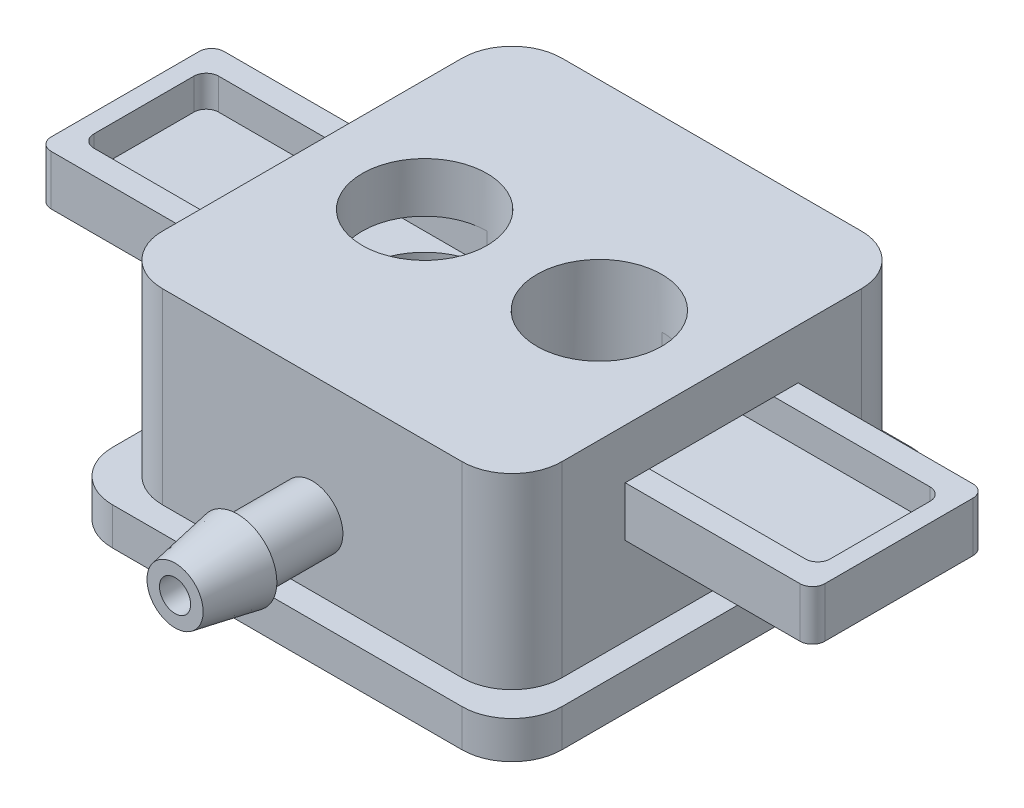
from build123d import *

# Parameters (mm, degrees)
BOSS_EXTRUDE2_DEPTH            = 7
BOSS_EXTRUDE3_DEPTH            = 2
CUT_EXTRUDE1_DEPTH             = 1.25
SKETCH6_R                      = 2.5
BOSS_EXTRUDE4_DEPTH            = 2
BOSS_EXTRUDE5_DEPTH            = 1.5
SKETCH7_R                      = 2.5
CUT_EXTRUDE2_DEPTH             = 19.823190484
SKETCH18_R                     = 0.625
CUT_EXTRUDE5_DEPTH             = 8.5
CUT_EXTRUDE6_REACH             = 24.439
SKETCH20_R                     = 0.625
CUT_EXTRUDE6_DIRECTION_2_REACH = 24.439


with BuildPart() as part:
    # Sketch3 → Boss-Extrude2 (new body)
    with BuildSketch(Plane(origin=(0, 0, 0), x_dir=(1, 0, 0), z_dir=(0, 1, 0))):
        with BuildLine():
            Line((-6, -8), (6, -8))
            ThreePointArc((6, -8), (7.414213562, -7.414213562), (8, -6))
            Line((8, -6), (8, 6))
            ThreePointArc((8, 6), (7.414213562, 7.414213562), (6, 8))
            Line((6, 8), (-6, 8))
            ThreePointArc((-6, 8), (-7.414213562, 7.414213562), (-8, 6))
            Line((-8, 6), (-8, -6))
            ThreePointArc((-8, -6), (-7.414213562, -7.414213562), (-6, -8))
        make_face()
    extrude(amount=BOSS_EXTRUDE2_DEPTH)

    # Sketch4 → Boss-Extrude3 (add)
    with BuildSketch(Plane(origin=(0, 7, 0), x_dir=(1, 0, 0), z_dir=(0, 1, 0))):
        with BuildLine():
            Line((-8, -3.465), (-8, 3.465))
            Line((-8, 3.465), (-15, 3.465))
            ThreePointArc((-15, 3.465), (-15.353553391, 3.318553391), (-15.5, 2.965))
            Line((-15.5, 2.965), (-15.5, -2.965))
            ThreePointArc((-15.5, -2.965), (-15.353553391, -3.318553391), (-15, -3.465))
            Line((-15, -3.465), (-8, -3.465))
        make_face()
        with BuildLine():
            Line((15, 3.465), (8, 3.465))
            Line((8, 3.465), (8, -3.465))
            Line((8, -3.465), (15, -3.465))
            ThreePointArc((15, -3.465), (15.353553391, -3.318553391), (15.5, -2.965))
            Line((15.5, -2.965), (15.5, 2.965))
            ThreePointArc((15.5, 2.965), (15.353553391, 3.318553391), (15, 3.465))
        make_face()
    extrude(amount=-BOSS_EXTRUDE3_DEPTH)

    # Sketch5 → Cut-Extrude1 (cut)
    with BuildSketch(Plane(origin=(0, 7, 0), x_dir=(1, 0, 0), z_dir=(0, 1, 0))):
        with BuildLine():
            Line((-3.5, 2.5), (-14.25, 2.5))
            ThreePointArc((-14.25, 2.5), (-14.603553391, 2.353553391), (-14.75, 2))
            Line((-14.75, 2), (-14.75, -2))
            ThreePointArc((-14.75, -2), (-14.603553391, -2.353553391), (-14.25, -2.5))
            Line((-14.25, -2.5), (-3.5, -2.5))
            ThreePointArc((-3.5, -2.5), (-1, 0), (-3.5, 2.5))
        make_face()
        with BuildLine():
            Line((3.5, 2.5), (14.25, 2.5))
            ThreePointArc((14.25, 2.5), (14.603553391, 2.353553391), (14.75, 2))
            Line((14.75, 2), (14.75, -2))
            ThreePointArc((14.75, -2), (14.603553391, -2.353553391), (14.25, -2.5))
            Line((14.25, -2.5), (3.5, -2.5))
            ThreePointArc((3.5, -2.5), (1, 0), (3.5, 2.5))
        make_face()
    extrude(amount=-CUT_EXTRUDE1_DEPTH, mode=Mode.SUBTRACT)

    # Sketch6 → Boss-Extrude4 (add)
    with BuildSketch(Plane(origin=(0, 7, 0), x_dir=(1, 0, 0), z_dir=(0, 1, 0))):
        with BuildLine():
            Line((-6, -8), (6, -8))
            ThreePointArc((6, -8), (7.414213562, -7.414213562), (8, -6))
            Line((8, -6), (8, 6))
            ThreePointArc((8, 6), (7.414213562, 7.414213562), (6, 8))
            Line((6, 8), (-6, 8))
            ThreePointArc((-6, 8), (-7.414213562, 7.414213562), (-8, 6))
            Line((-8, 6), (-8, -6))
            ThreePointArc((-8, -6), (-7.414213562, -7.414213562), (-6, -8))
        make_face()
        with Locations((3.5, 0)):
            Circle(SKETCH6_R, mode=Mode.SUBTRACT)
        with Locations((-3.5, 0)):
            Circle(SKETCH6_R, mode=Mode.SUBTRACT)
    extrude(amount=BOSS_EXTRUDE4_DEPTH)

    # Sketch8 → Boss-Extrude5 (add)
    with BuildSketch(Plane.XZ):
        with BuildLine():
            Line((-7, -9), (7, -9))
            ThreePointArc((7, -9), (8.414213562, -8.414213562), (9, -7))
            Line((9, -7), (9, 7))
            ThreePointArc((9, 7), (8.414213562, 8.414213562), (7, 9))
            Line((7, 9), (-7, 9))
            ThreePointArc((-7, 9), (-8.414213562, 8.414213562), (-9, 7))
            Line((-9, 7), (-9, -7))
            ThreePointArc((-9, -7), (-8.414213562, -8.414213562), (-7, -9))
        make_face()
    extrude(amount=-BOSS_EXTRUDE5_DEPTH)

    # Sketch7 → Cut-Extrude2 (cut, through all)
    with BuildSketch(Plane(origin=(0, 5.75, 0), x_dir=(1, 0, 0), z_dir=(0, 1, 0))):
        with Locations((-3.5, 0)):
            Circle(SKETCH7_R)
        with Locations((3.5, 0)):
            Circle(SKETCH7_R)
    extrude(amount=-CUT_EXTRUDE2_DEPTH, mode=Mode.SUBTRACT)

    # Sketch13 → Revolve1 (revolve)
    with BuildSketch(Plane(origin=(0, 0, 0), x_dir=(0, 0, -1), z_dir=(1, 0, 0))):
        Polygon((-8, 3.479112133), (-13.5, 3.479112133), (-13.5, 2.979112133), (-11, 2.525029687), (-11, 2.879112133), (-8, 2.879112133), align=None)
    revolve(axis=Axis((0, 4.104112133, 8), (0, 0, 1)))

    # Sketch18 → Cut-Extrude5 (cut)
    with BuildSketch(Plane.XY.offset(8)):
        with Locations((0, 4.104112133)):
            Circle(SKETCH18_R)
    extrude(amount=-CUT_EXTRUDE5_DEPTH, mode=Mode.SUBTRACT)

    # Sketch20 → Cut-Extrude6 (cut, up to next)
    with BuildSketch(Plane(origin=(0, 0, 0), x_dir=(0, 0, -1), z_dir=(1, 0, 0)), mode=Mode.PRIVATE) as cut_extrude6_sk1:
        with Locations((0.5, 4.104112133)):
            Circle(SKETCH20_R)
    cut_extrude6_tool1 = extrude(cut_extrude6_sk1.sketch, amount=-CUT_EXTRUDE6_REACH, mode=Mode.PRIVATE) & part.part
    add(cut_extrude6_tool1.solids().sort_by_distance((0, 4.104112, -0.5))[0], mode=Mode.SUBTRACT)

    # Sketch20 → Cut-Extrude6 direction 2 (cut, up to next)
    with BuildSketch(Plane(origin=(0, 0, 0), x_dir=(0, 0, -1), z_dir=(1, 0, 0)), mode=Mode.PRIVATE) as cut_extrude6_direction_2_sk1:
        with Locations((0.5, 4.104112133)):
            Circle(SKETCH20_R)
    cut_extrude6_direction_2_tool1 = extrude(cut_extrude6_direction_2_sk1.sketch, amount=CUT_EXTRUDE6_DIRECTION_2_REACH, mode=Mode.PRIVATE) & part.part
    add(cut_extrude6_direction_2_tool1.solids().sort_by_distance((0, 4.104112, -0.5))[0], mode=Mode.SUBTRACT)


solid = part.part
